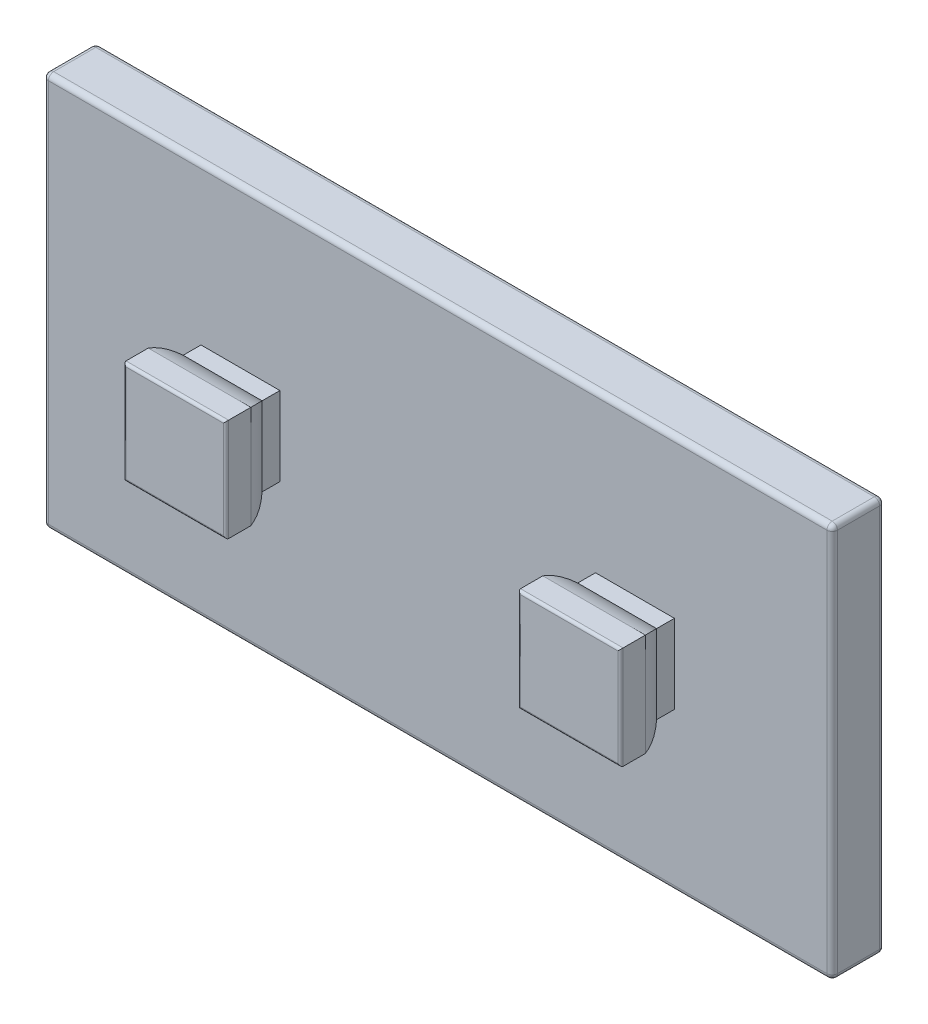
from build123d import *

# Parameters (mm, degrees)
SKETCH_1_W                      = 30
SKETCH_1_H                      = 15
EXTRUDE_1_DEPTH                 = 2
SKETCH_2_W                      = 3
SKETCH_2_H                      = 3
EXTRUDE_2_DEPTH                 = 1
EXTRUDE_3_DEPTH                 = 2
CUT_EXTRUDE_1_REACH             = 25.848
CUT_EXTRUDE_1_DIRECTION_2_REACH = 25.848
FILLET_1_R                      = 0.1
FILLET_1_OF_MIRROR_1_R          = 0.1
FILLET_3_R                      = 0.2


with BuildPart() as part:
    # 草图1 → 凸台-拉伸1 (new body)
    with BuildSketch(Plane.XY):
        with Locations((7.5, 0)):
            Rectangle(SKETCH_1_W, SKETCH_1_H)
    extrude(amount=-EXTRUDE_1_DEPTH)

    # 草图2 → 凸台-拉伸2 (add)
    with BuildSketch(Plane.XY):
        Rectangle(SKETCH_2_W, SKETCH_2_H)
    extrude_2 = extrude(amount=EXTRUDE_2_DEPTH)

    # 草图3 → 凸台-拉伸3 (add, symmetric)
    with BuildSketch(Plane(origin=(0, 0, 0), x_dir=(1, 0, 0), z_dir=(0, 1, 0))):
        with BuildLine():
            Line((-1.95, -2.5), (1.95, -2.5))
            Line((1.95, -2.5), (1.95, -1.555590279))
            ThreePointArc((1.95, -1.555590279), (1.780042303, -1.088161527), (1.5, -0.677124344))
            Line((1.5, -0.677124344), (-1.5, -0.677124344))
            ThreePointArc((-1.5, -0.677124344), (-1.780042303, -1.088161527), (-1.95, -1.555590279))
            Line((-1.95, -1.555590279), (-1.95, -2.5))
        make_face()
    extrude_3 = extrude(amount=EXTRUDE_3_DEPTH, both=True)

    # 草图4 → 切除-拉伸1 (cut, up to next)
    with BuildSketch(Plane(origin=(0, 0, 0), x_dir=(0, 0, -1), z_dir=(1, 0, 0)), mode=Mode.PRIVATE) as cut_extrude_1_sk1:
        with BuildLine():
            Line((-2.5, 1.95), (-1.555590279, 1.95))
            ThreePointArc((-1.555590279, 1.95), (-1.088161527, 1.780042303), (-0.677124344, 1.5))
            Line((-0.677124344, 1.5), (-0.677124344, 2))
            Line((-0.677124344, 2), (-2.5, 2))
            Line((-2.5, 2), (-2.5, 1.95))
        make_face()
    cut_extrude_1_tool1 = extrude(cut_extrude_1_sk1.sketch, amount=-CUT_EXTRUDE_1_REACH, mode=Mode.PRIVATE) & part.part
    # 草图4 → 切除-拉伸1 (cut, up to next)
    with BuildSketch(Plane(origin=(0, 0, 0), x_dir=(0, 0, -1), z_dir=(1, 0, 0)), mode=Mode.PRIVATE) as cut_extrude_1_sk2:
        with BuildLine():
            Line((-2.5, -2), (-0.677124344, -2))
            Line((-0.677124344, -2), (-0.677124344, -1.5))
            ThreePointArc((-0.677124344, -1.5), (-1.088161527, -1.780042303), (-1.555590279, -1.95))
            Line((-1.555590279, -1.95), (-2.5, -1.95))
            Line((-2.5, -1.95), (-2.5, -2))
        make_face()
    cut_extrude_1_tool2 = extrude(cut_extrude_1_sk2.sketch, amount=-CUT_EXTRUDE_1_REACH, mode=Mode.PRIVATE) & part.part
    cut_extrude_1_1 = cut_extrude_1_tool1.solids().sort_by_distance((0, 1.873038, 1.175075))[0]
    add(cut_extrude_1_1, mode=Mode.SUBTRACT)
    cut_extrude_1_2 = cut_extrude_1_tool2.solids().sort_by_distance((0, -1.873038, 1.175075))[0]
    add(cut_extrude_1_2, mode=Mode.SUBTRACT)
    cut_extrude_1 = cut_extrude_1_1 + cut_extrude_1_2  # 切除-拉伸1 as one shape, for the pattern or mirror that repeats it

    # 草图4 → 切除-拉伸1 direction 2 (cut, up to next)
    with BuildSketch(Plane(origin=(0, 0, 0), x_dir=(0, 0, -1), z_dir=(1, 0, 0)), mode=Mode.PRIVATE) as cut_extrude_1_direction_2_sk1:
        with BuildLine():
            Line((-2.5, 1.95), (-1.555590279, 1.95))
            ThreePointArc((-1.555590279, 1.95), (-1.088161527, 1.780042303), (-0.677124344, 1.5))
            Line((-0.677124344, 1.5), (-0.677124344, 2))
            Line((-0.677124344, 2), (-2.5, 2))
            Line((-2.5, 2), (-2.5, 1.95))
        make_face()
    cut_extrude_1_direction_2_tool1 = extrude(cut_extrude_1_direction_2_sk1.sketch, amount=CUT_EXTRUDE_1_DIRECTION_2_REACH, mode=Mode.PRIVATE) & part.part
    # 草图4 → 切除-拉伸1 direction 2 (cut, up to next)
    with BuildSketch(Plane(origin=(0, 0, 0), x_dir=(0, 0, -1), z_dir=(1, 0, 0)), mode=Mode.PRIVATE) as cut_extrude_1_direction_2_sk2:
        with BuildLine():
            Line((-2.5, -2), (-0.677124344, -2))
            Line((-0.677124344, -2), (-0.677124344, -1.5))
            ThreePointArc((-0.677124344, -1.5), (-1.088161527, -1.780042303), (-1.555590279, -1.95))
            Line((-1.555590279, -1.95), (-2.5, -1.95))
            Line((-2.5, -1.95), (-2.5, -2))
        make_face()
    cut_extrude_1_direction_2_tool2 = extrude(cut_extrude_1_direction_2_sk2.sketch, amount=CUT_EXTRUDE_1_DIRECTION_2_REACH, mode=Mode.PRIVATE) & part.part
    cut_extrude_1_direction_2_1 = cut_extrude_1_direction_2_tool1.solids().sort_by_distance((0, 1.873038, 1.175075))[0]
    add(cut_extrude_1_direction_2_1, mode=Mode.SUBTRACT)
    cut_extrude_1_direction_2_2 = cut_extrude_1_direction_2_tool2.solids().sort_by_distance((0, -1.873038, 1.175075))[0]
    add(cut_extrude_1_direction_2_2, mode=Mode.SUBTRACT)
    cut_extrude_1_direction_2 = cut_extrude_1_direction_2_1 + cut_extrude_1_direction_2_2  # 切除-拉伸1 direction 2 as one shape, for the pattern or mirror that repeats it

    # 圆角1
    fillet_1_edges = [part.edges().sort_by_distance(p)[0] for p in [
        (-1.95, 0, 2.5),
        (1.95, 0, 2.5),
        (0, -1.95, 2.5),
        (0, 1.95, 2.5),
    ]]
    fillet(fillet_1_edges, radius=FILLET_1_R)

    # 镜向1: 凸台-拉伸2, 凸台-拉伸3, 切除-拉伸1, 切除-拉伸1 direction 2 across plane
    add(extrude_2.mirror(Plane(origin=(7.5, 0, 0), x_dir=(0, 0, 1), z_dir=(1, 0, 0))))
    add(extrude_3.mirror(Plane(origin=(7.5, 0, 0), x_dir=(0, 0, 1), z_dir=(1, 0, 0))))
    add(cut_extrude_1.mirror(Plane(origin=(7.5, 0, 0), x_dir=(0, 0, 1), z_dir=(1, 0, 0))), mode=Mode.SUBTRACT)
    add(cut_extrude_1_direction_2.mirror(Plane(origin=(7.5, 0, 0), x_dir=(0, 0, 1), z_dir=(1, 0, 0))), mode=Mode.SUBTRACT)

    # 圆角1 of 镜向1
    fillet_1_of_mirror_1_edges = [part.edges().sort_by_distance(p)[0] for p in [
        (16.95, 0, 2.5),
        (13.05, 0, 2.5),
        (15, -1.95, 2.5),
        (15, 1.95, 2.5),
    ]]
    fillet(fillet_1_of_mirror_1_edges, radius=FILLET_1_OF_MIRROR_1_R)

    # 圆角3
    fillet_3_edges = [part.edges().sort_by_distance(p)[0] for p in [
        (22.5, 0, -2),
        (7.5, 7.5, -2),
        (-7.5, 0, -2),
        (7.5, 7.5, 0),
        (22.5, 0, 0),
        (7.5, -7.5, 0),
        (-7.5, 0, 0),
        (7.5, -7.5, -2),
        (-7.5, 7.5, -1),
        (22.5, 7.5, -1),
        (22.5, -7.5, -1),
        (-7.5, -7.5, -1),
    ]]
    fillet(fillet_3_edges, radius=FILLET_3_R)


solid = part.part
